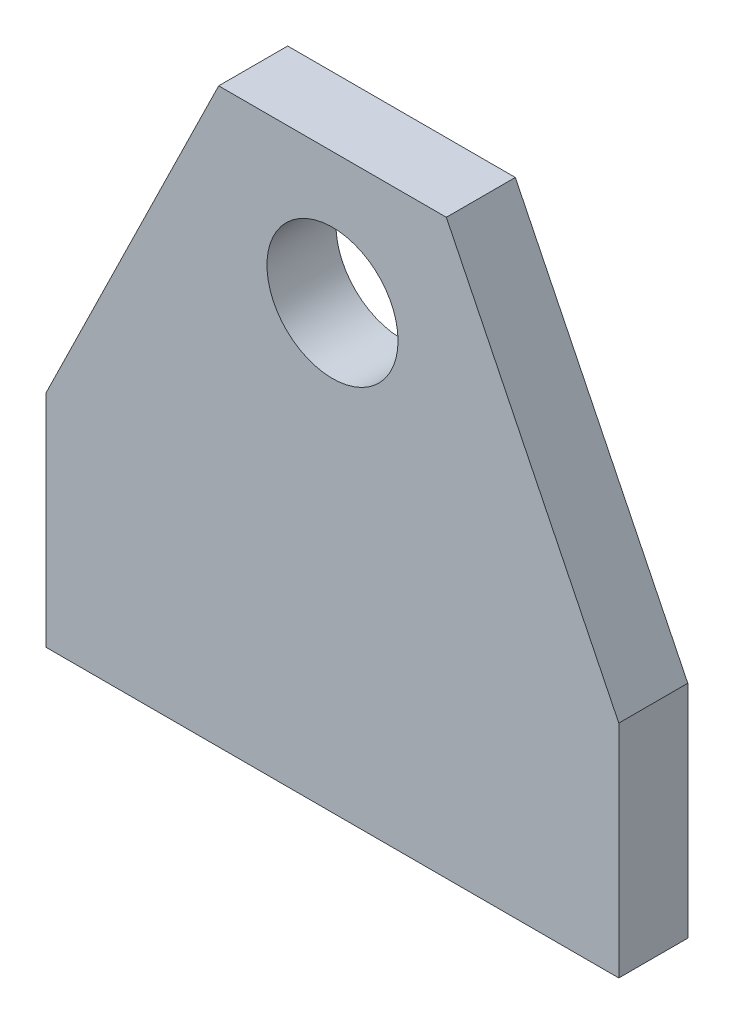
from build123d import *

# Parameters (mm, degrees)
SKETCH1_R          = 9.5
BASE_EXTRUDE_DEPTH = 10


with BuildPart() as part:
    # Sketch1 → Base-Extrude (new body)
    with BuildSketch(Plane.XY):
        Polygon((-16.5, 83), (16.5, 83), (41.5, 32), (41.5, 0), (-41.5, 0), (-41.5, 32), align=None)
        with Locations((0, 64)):
            Circle(SKETCH1_R, mode=Mode.SUBTRACT)
    extrude(amount=BASE_EXTRUDE_DEPTH)


solid = part.part
